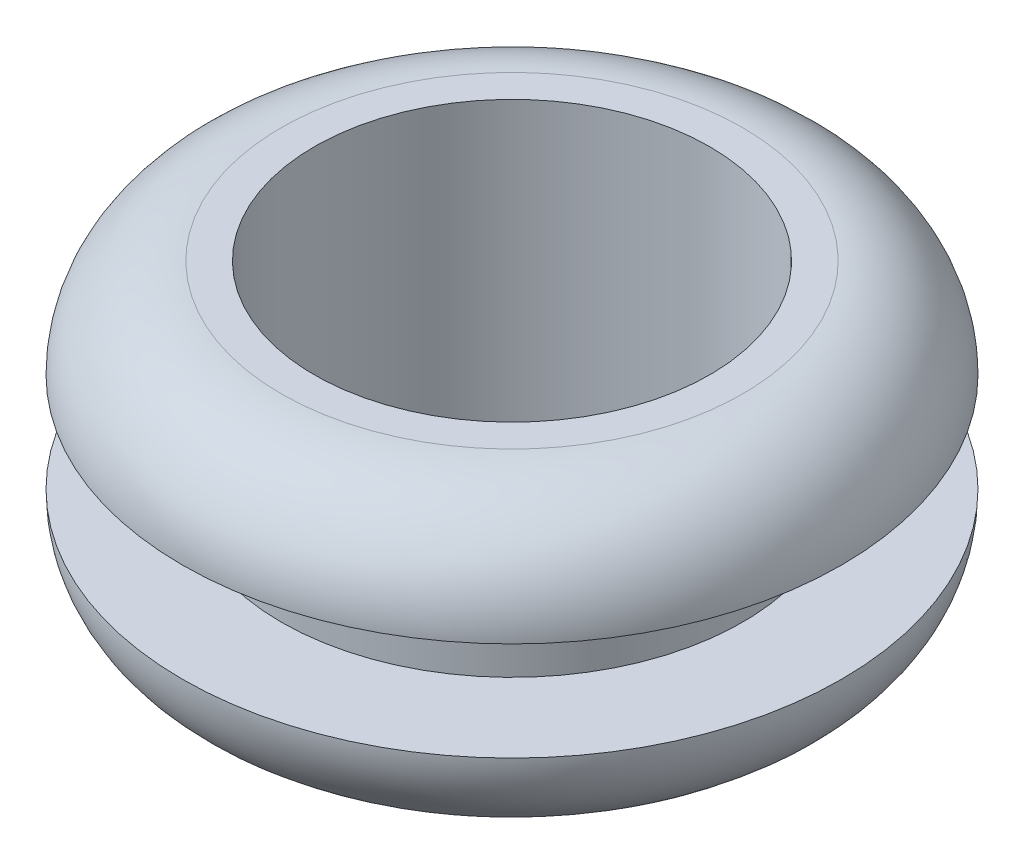
from build123d import *


with BuildPart() as part:
    # Sketch2 → Revolve1 (revolve)
    with BuildSketch(Plane(origin=(0, 0, 0), x_dir=(0, 0, -1), z_dir=(1, 0, 0)), mode=Mode.PRIVATE) as revolve1_sk:
        with BuildLine():
            Line((-4.7625, -3.571875), (-4.7625, 3.571875))
            Line((-4.7625, 3.571875), (-5.55625, 3.571875))
            ThreePointArc((-5.55625, 3.571875), (-7.240048023, 2.874423023), (-7.9375, 1.190625))
            Line((-7.9375, 1.190625), (-5.55625, 1.190625))
            Line((-5.55625, 1.190625), (-5.55625, -1.190625))
            Line((-5.55625, -1.190625), (-7.9375, -1.190625))
            ThreePointArc((-7.9375, -1.190625), (-7.240048023, -2.874423023), (-5.55625, -3.571875))
            Line((-5.55625, -3.571875), (-4.7625, -3.571875))
        make_face()
    revolve(revolve1_sk.sketch.rotate(Axis((0, -3.571875, 0), (0, 1, 0)), 180), axis=Axis((0, -3.571875, 0), (0, 1, 0)))


solid = part.part
